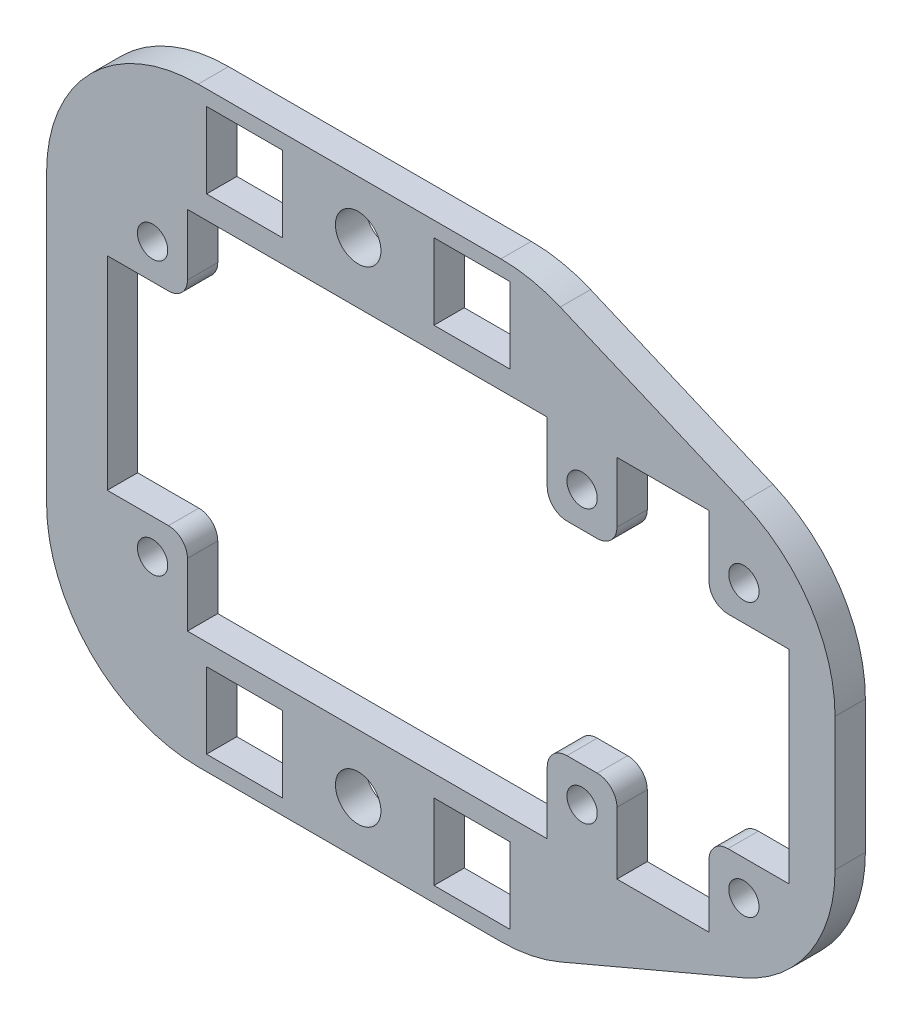
from build123d import *

# Parameters (mm, degrees)
ESQUISSE1_R        = 1.5
ESQUISSE1_W        = 5
ESQUISSE1_H        = 5
BOSS_EXTRU_1_DEPTH = 2
FILLET1_R          = 10


with BuildPart() as part:
    # Esquisse1 → Boss.-Extru.1 (new body)
    with BuildSketch(Plane.XY):
        Polygon((-4, -19.5), (-4, 19.5), (28, 19.5), (48, 11), (48, -11), (28, -19.5), align=None)
        with Locations((16.548051812, 15.999999999)):
            Circle(ESQUISSE1_R, mode=Mode.SUBTRACT)
        with Locations((16.548051812, -16.000000001)):
            Circle(ESQUISSE1_R, mode=Mode.SUBTRACT)
        with BuildLine():
            Line((4.03758425, 6.699965485), (0, 6.699965485))
            Line((0, 6.699965485), (0, -6.699965485))
            Line((0, -6.699965485), (4.037591434, -6.700034515))
            ThreePointArc((4.037591434, -6.700034515), (4.921479782, -7.066148374), (5.28759897, -7.950034515))
            Line((5.28759897, -7.950034515), (5.28759897, -12.100034515))
            Line((5.28759897, -12.100034515), (29.015776303, -12.100034515))
            Line((29.015776303, -12.100034515), (29.015776303, -8.000038733))
            ThreePointArc((29.015776303, -8.000038733), (29.396536008, -7.080797161), (30.315776345, -6.700034473))
            Line((30.315776345, -6.700034473), (32.315776344, -6.700034473))
            ThreePointArc((32.315776344, -6.700034473), (33.23501504, -7.080795537), (33.615776345, -8.000034132))
            Line((33.615776345, -8.000034132), (33.615776345, -12.100034515))
            Line((33.615776345, -12.100034515), (39.687598777, -12.100034515))
            Line((39.687598777, -12.100034515), (39.687598777, -7.950039613))
            ThreePointArc((39.687598777, -7.950039613), (40.053713738, -7.066152541), (40.937599481, -6.70003437))
            Line((40.937599481, -6.70003437), (44.975197892, -6.70003437))
            Line((44.975197892, -6.70003437), (44.975197892, 6.699965437))
            Line((44.975197892, 6.699965437), (40.9376034, 6.699965437))
            ThreePointArc((40.9376034, 6.699965437), (40.053716981, 7.066080502), (39.68759897, 7.949965701))
            Line((39.68759897, 7.949965701), (39.68759897, 11.987564455))
            Line((39.68759897, 11.987564455), (33.615776432, 11.987564455))
            Line((33.615776432, 11.987564455), (33.615776432, 7.999969389))
            ThreePointArc((33.615776432, 7.999969389), (33.235016597, 7.080728053), (32.315776389, 6.699965495))
            Line((32.315776389, 6.699965495), (30.31577639, 6.699965495))
            ThreePointArc((30.31577639, 6.699965495), (29.396537621, 7.080726637), (29.015776399, 7.999965373))
            Line((29.015776399, 7.999965373), (29.015776399, 11.987564455))
            Line((29.015776399, 11.987564455), (5.28759897, 11.987564455))
            Line((5.28759897, 11.987564455), (5.28759897, 7.949965485))
            ThreePointArc((5.28759897, 7.949965485), (4.921477242, 7.066076805), (4.03758425, 6.699965485))
        make_face(mode=Mode.SUBTRACT)
        with BuildLine():
            ThreePointArc((31.315776387, 9.999965485), (30.315776387, 8.999965485), (31.315776387, 7.999965485))
            ThreePointArc((31.315776387, 7.999965485), (32.315776387, 8.999965485), (31.315776387, 9.999965485))
        make_face(mode=Mode.SUBTRACT)
        with BuildLine():
            ThreePointArc((42.98759897, 8.999965485), (41.98759897, 9.999965485), (40.98759897, 8.999965485))
            ThreePointArc((40.98759897, 8.999965485), (41.98759897, 7.999965485), (42.98759897, 8.999965485))
        make_face(mode=Mode.SUBTRACT)
        with BuildLine():
            ThreePointArc((42.98759897, -9.000034515), (41.98759897, -8.000034515), (40.98759897, -9.000034515))
            ThreePointArc((40.98759897, -9.000034515), (41.98759897, -10.000034515), (42.98759897, -9.000034515))
        make_face(mode=Mode.SUBTRACT)
        with BuildLine():
            ThreePointArc((31.315776387, -8.000034515), (30.315776387, -9.000034515), (31.315776387, -10.000034515))
            ThreePointArc((31.315776387, -10.000034515), (32.315776387, -9.000034515), (31.315776387, -8.000034515))
        make_face(mode=Mode.SUBTRACT)
        with BuildLine():
            ThreePointArc((1.98759897, -9.000034515), (2.98759897, -10.000034515), (3.98759897, -9.000034515))
            ThreePointArc((3.98759897, -9.000034515), (2.98759897, -8.000034515), (1.98759897, -9.000034515))
        make_face(mode=Mode.SUBTRACT)
        with BuildLine():
            ThreePointArc((1.98759897, 8.999965485), (2.98759897, 7.999965485), (3.98759897, 8.999965485))
            ThreePointArc((3.98759897, 8.999965485), (2.98759897, 9.999965485), (1.98759897, 8.999965485))
        make_face(mode=Mode.SUBTRACT)
        with Locations((9.048051812, 15.999999999)):
            Rectangle(ESQUISSE1_W, ESQUISSE1_H, mode=Mode.SUBTRACT)
        with Locations((24.048051812, 15.999999999)):
            Rectangle(ESQUISSE1_W, ESQUISSE1_H, mode=Mode.SUBTRACT)
        with Locations((9.048051812, -16.000000001)):
            Rectangle(ESQUISSE1_W, ESQUISSE1_H, mode=Mode.SUBTRACT)
        with Locations((24.048051812, -16.000000001)):
            Rectangle(ESQUISSE1_W, ESQUISSE1_H, mode=Mode.SUBTRACT)
    extrude(amount=BOSS_EXTRU_1_DEPTH)

    # Fillet1
    fillet1_edges = [part.edges().sort_by_distance(p)[0] for p in [
        (-4, -19.5, 1),
        (-4, 19.5, 1),
        (28, 19.5, 1),
        (48, 11, 1),
        (48, -11, 1),
        (28, -19.5, 1),
    ]]
    fillet(fillet1_edges, radius=FILLET1_R)


solid = part.part
